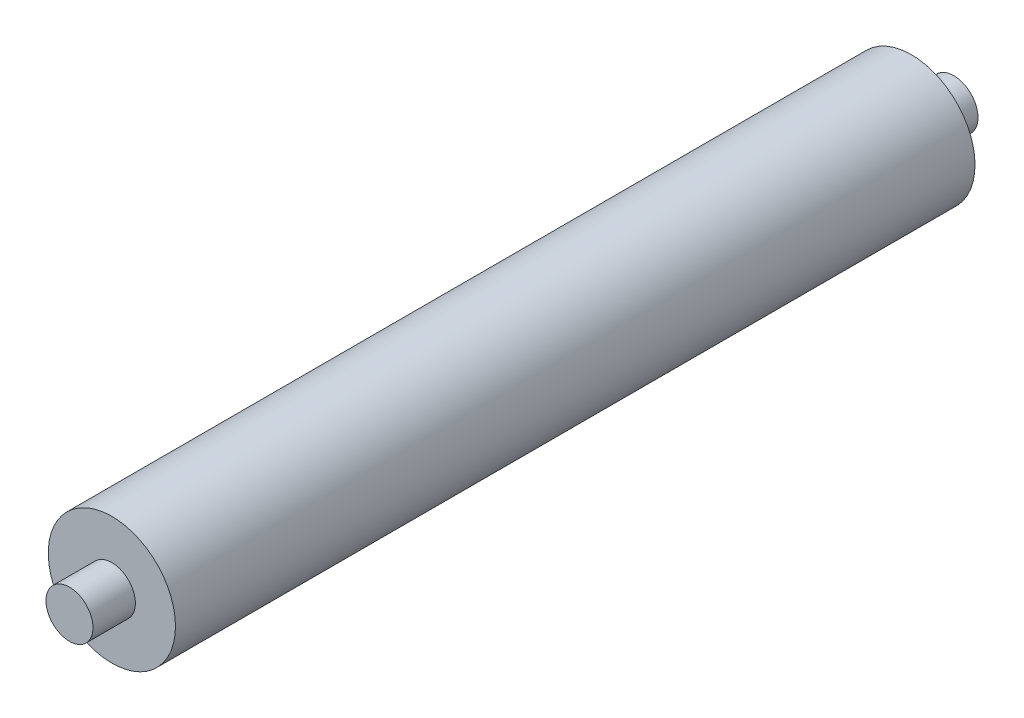
from build123d import *

# Parameters (mm, degrees)
SKETCH_1_R      = 10.5
EXTRUDE_1_DEPTH = 132
SKETCH_2_R      = 3.882086968
EXTRUDE_2_DEPTH = 7
SKETCH_5_R      = 4
EXTRUDE_3_DEPTH = 7


with BuildPart() as part:
    # 草图1 → 凸台-拉伸1 (new body)
    with BuildSketch(Plane.XY):
        Circle(SKETCH_1_R)
    extrude(amount=EXTRUDE_1_DEPTH)

    # 草图2 → 凸台-拉伸2 (add)
    with BuildSketch(Plane.XY.offset(132)):
        Circle(SKETCH_2_R)
    extrude(amount=EXTRUDE_2_DEPTH)

    # 草图5 → 凸台-拉伸3 (add)
    with BuildSketch(Plane(origin=(0, 0, 0), x_dir=(-1, 0, 0), z_dir=(0, 0, -1))):
        Circle(SKETCH_5_R)
    extrude(amount=EXTRUDE_3_DEPTH)


solid = part.part
